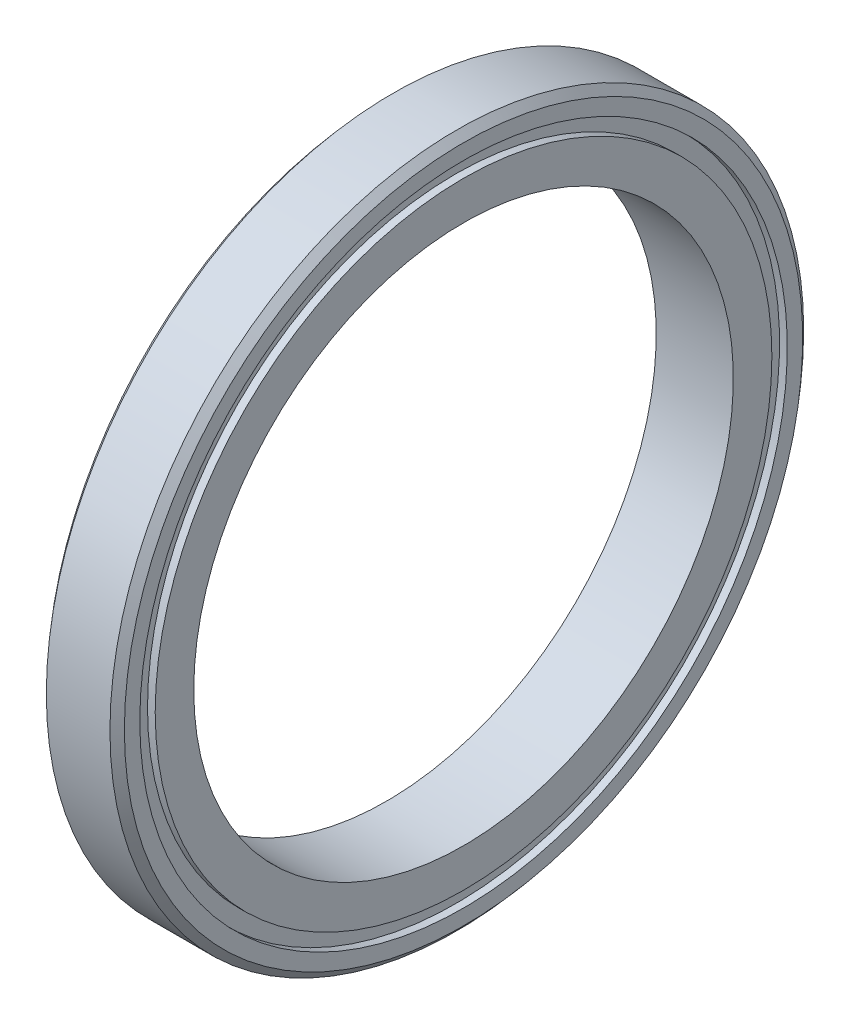
from build123d import *


with BuildPart() as part:
    # Sketch1 → Revolve1 (revolve)
    with BuildSketch(Plane.XY, mode=Mode.PRIVATE) as revolve1_sk:
        Polygon((2.844698491, 40), (1.844698491, 40), (1.844698491, 42), (2.844698491, 42), (2.844698491, 44), (1.97151331, 45), (-6.282116328, 45), (-7.155301509, 44), (-7.155301509, 42), (-6.155301509, 42), (-6.155301509, 40), (-7.155301509, 40), (-7.155301509, 35), (2.844698491, 35), align=None)
    revolve(revolve1_sk.sketch.rotate(Axis((0, 0, 0), (1, 0, 0)), 90), axis=Axis((0, 0, 0), (1, 0, 0)))


solid = part.part
